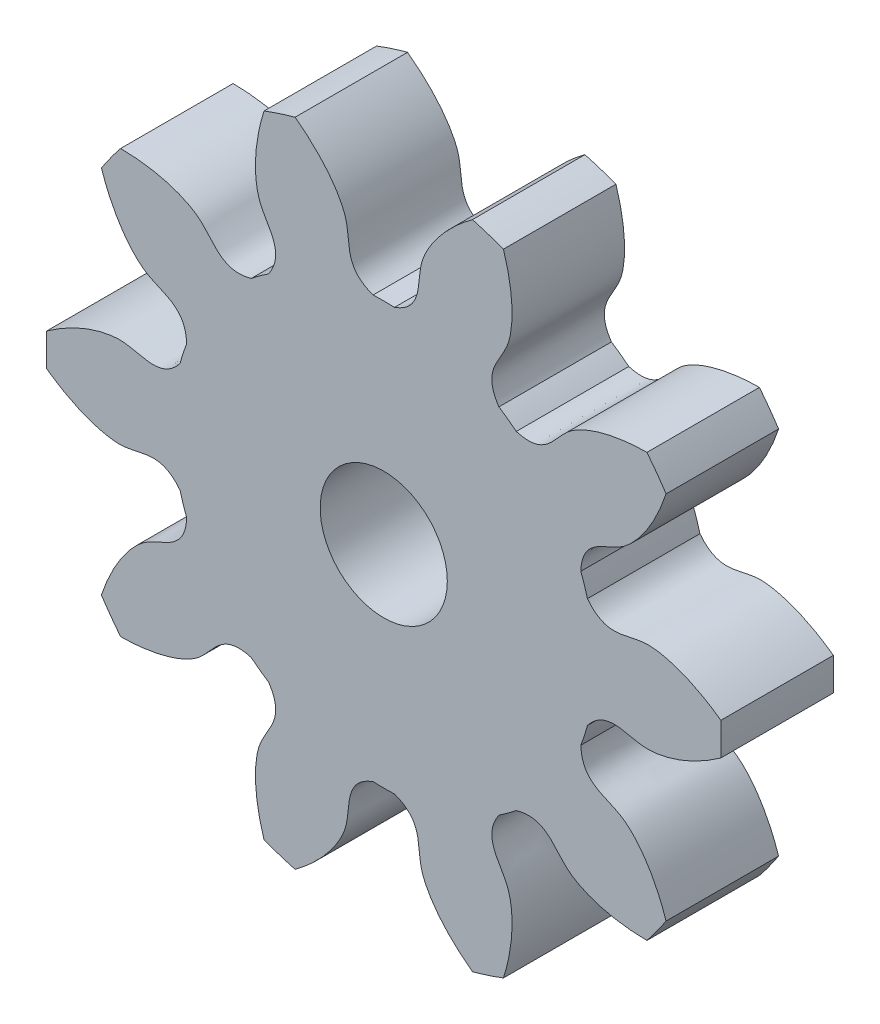
from build123d import *

# Parameters (mm, degrees)
SKETCH_1_R               = 3
EXTRUDE_1_DEPTH          = 1
CUT_EXTRUDE_1_DEPTH      = 5.358898944
PATTERN_CIRCULAR_1_COUNT = 10
SKETCH_4_R               = 0.565
CUT_EXTRUDE_2_DEPTH      = 10


with BuildPart() as part:
    # 草图1 → 凸台-拉伸1 (new body)
    with BuildSketch(Plane.XY):
        Circle(SKETCH_1_R)
    extrude(amount=EXTRUDE_1_DEPTH)

    # 草图2 → 切除-拉伸1 (cut, through all)
    with BuildSketch(Plane.XY):
        with BuildLine():
            ThreePointArc((0.095229133, 1.872580148), (0, 1.875), (-0.095229133, 1.872580148))
            add(Edge.make_bspline(
                [(-0.095229133, 1.872580148), (-0.362715165, 1.970284093), (-0.286920777, 2.185294723), (-0.344330803, 2.362336277), (-0.347251515, 2.37077245), (-0.350665635, 2.380030264), (-0.35460634, 2.390093167), (-0.359107284, 2.400943399), (-0.364201322, 2.412562246), (-0.369920867, 2.424929978), (-0.376297744, 2.438025881), (-0.383363205, 2.451828275), (-0.391147884, 2.466314521), (-0.399681784, 2.481461042), (-0.408994243, 2.497243338), (-0.419113912, 2.513636003), (-0.430068732, 2.530612743), (-0.441885908, 2.548146397), (-0.454591887, 2.566208951), (-0.468212335, 2.58477156), (-0.482772111, 2.603804571), (-0.498295251, 2.623277538), (-0.514804941, 2.64315925), (-0.532323498, 2.663417745), (-0.550872351, 2.68402034), (-0.570472019, 2.704933651), (-0.591142092, 2.726123613), (-0.612901212, 2.747555509), (-0.635767055, 2.769193992), (-0.659756316, 2.79100311), (-0.684884687, 2.812946332), (-0.711166843, 2.834986573), (-0.73861643, 2.857086218), (-0.767246042, 2.879207155), (-0.797067213, 2.901310796), (-0.828090401, 2.923358104), (-0.860324974, 2.945309627), (-0.8937792, 2.967125519), (-0.928460232, 2.988765572), (-0.964374099, 3.010189244), (-1.001525696, 3.031355689), (-1.039918773, 3.052223783), (-1.079555927, 3.072752157), (-1.120438592, 3.092899225), (-1.162567035, 3.112623216), (-1.205940346, 3.131882201), (-1.250556433, 3.150634125), (-1.296412017, 3.168836838), (-1.343502628, 3.186448125), (-1.3918226, 3.203425737), (-1.441365068, 3.219727424), (-1.492121969, 3.235310961), (-1.544084033, 3.250134185), (-1.597240793, 3.264155023), (-1.651580574, 3.277331523), (-1.707090504, 3.289621887), (-1.763756505, 3.300984501), (-1.821563307, 3.311377967), (-1.880494441, 3.320761135), (-1.940532246, 3.329093134), (-2.022655253, 3.338820511), (-2.084917451, 3.344293469), (-2.126793313, 3.34714445)],
                knots=[0, 0, 0, 0, 0.201720712, 0.204696754, 0.208022917, 0.211699204, 0.215725612, 0.220102144, 0.224828797, 0.229905574, 0.235332472, 0.241109493, 0.247236637, 0.253713903, 0.260541292, 0.267718803, 0.275246437, 0.283124193, 0.291352071, 0.299930073, 0.308858196, 0.318136442, 0.327764811, 0.337743302, 0.348071916, 0.358750652, 0.36977951, 0.381158491, 0.392887595, 0.404966821, 0.41739617, 0.430175641, 0.443305234, 0.45678495, 0.470614789, 0.48479475, 0.499324833, 0.514205039, 0.529435368, 0.545015819, 0.560946392, 0.577227088, 0.593857907, 0.610838848, 0.628169911, 0.645851097, 0.663882406, 0.682263837, 0.70099539, 0.720077066, 0.739508864, 0.759290785, 0.779422829, 0.799904995, 0.820737283, 0.841919694, 0.863452227, 0.885334883, 0.907567662, 0.930150562, 0.953083586, 1, 1, 1, 1], degree=3))
            ThreePointArc((-2.126793313, 3.34714445), (0, 3.965680996), (2.126793313, 3.34714445))
            add(Edge.make_bspline(
                [(0.095229133, 1.872580148), (0.362715165, 1.970284093), (0.286920777, 2.185294723), (0.344330803, 2.362336277), (0.347251515, 2.37077245), (0.350665635, 2.380030264), (0.35460634, 2.390093167), (0.359107284, 2.400943399), (0.364201322, 2.412562246), (0.369920867, 2.424929978), (0.376297744, 2.438025881), (0.383363205, 2.451828275), (0.391147884, 2.466314521), (0.399681784, 2.481461042), (0.408994243, 2.497243338), (0.419113912, 2.513636003), (0.430068732, 2.530612743), (0.441885908, 2.548146397), (0.454591887, 2.566208951), (0.468212335, 2.58477156), (0.482772111, 2.603804571), (0.498295251, 2.623277538), (0.514804941, 2.64315925), (0.532323498, 2.663417745), (0.550872351, 2.68402034), (0.570472019, 2.704933651), (0.591142092, 2.726123613), (0.612901212, 2.747555509), (0.635767055, 2.769193992), (0.659756316, 2.79100311), (0.684884687, 2.812946332), (0.711166843, 2.834986573), (0.73861643, 2.857086218), (0.767246042, 2.879207155), (0.797067213, 2.901310796), (0.828090401, 2.923358104), (0.860324974, 2.945309627), (0.8937792, 2.967125519), (0.928460232, 2.988765572), (0.964374099, 3.010189244), (1.001525696, 3.031355689), (1.039918773, 3.052223783), (1.079555927, 3.072752157), (1.120438592, 3.092899225), (1.162567035, 3.112623216), (1.205940346, 3.131882201), (1.250556433, 3.150634125), (1.296412017, 3.168836838), (1.343502628, 3.186448125), (1.3918226, 3.203425737), (1.441365068, 3.219727424), (1.492121969, 3.235310961), (1.544084033, 3.250134185), (1.597240793, 3.264155023), (1.651580574, 3.277331523), (1.707090504, 3.289621887), (1.763756505, 3.300984501), (1.821563307, 3.311377967), (1.880494441, 3.320761135), (1.940532246, 3.329093134), (2.022655253, 3.338820511), (2.084917451, 3.344293469), (2.126793313, 3.34714445)],
                knots=[0, 0, 0, 0, 0.201720712, 0.204696754, 0.208022917, 0.211699204, 0.215725612, 0.220102144, 0.224828797, 0.229905574, 0.235332472, 0.241109493, 0.247236637, 0.253713903, 0.260541292, 0.267718803, 0.275246437, 0.283124193, 0.291352071, 0.299930073, 0.308858196, 0.318136442, 0.327764811, 0.337743302, 0.348071916, 0.358750652, 0.36977951, 0.381158491, 0.392887595, 0.404966821, 0.41739617, 0.430175641, 0.443305234, 0.45678495, 0.470614789, 0.48479475, 0.499324833, 0.514205039, 0.529435368, 0.545015819, 0.560946392, 0.577227088, 0.593857907, 0.610838848, 0.628169911, 0.645851097, 0.663882406, 0.682263837, 0.70099539, 0.720077066, 0.739508864, 0.759290785, 0.779422829, 0.799904995, 0.820737283, 0.841919694, 0.863452227, 0.885334883, 0.907567662, 0.930150562, 0.953083586, 1, 1, 1, 1], degree=3))
        make_face()
    cut_extrude_1 = extrude(amount=CUT_EXTRUDE_1_DEPTH, mode=Mode.SUBTRACT)

    # 阵列(圆周)1: 切除-拉伸1 ×10 about axis
    pattern_circular_1_axis = Axis((0, 0, -1.5), (0, 0, 1))
    for i in range(1, PATTERN_CIRCULAR_1_COUNT):
        add(cut_extrude_1.rotate(pattern_circular_1_axis, i * 360 / PATTERN_CIRCULAR_1_COUNT), mode=Mode.SUBTRACT)

    # 草图4 → 切除-拉伸2 (cut)
    with BuildSketch(Plane.XY.offset(1)):
        Circle(SKETCH_4_R)
    extrude(amount=-CUT_EXTRUDE_2_DEPTH, mode=Mode.SUBTRACT)


solid = part.part
